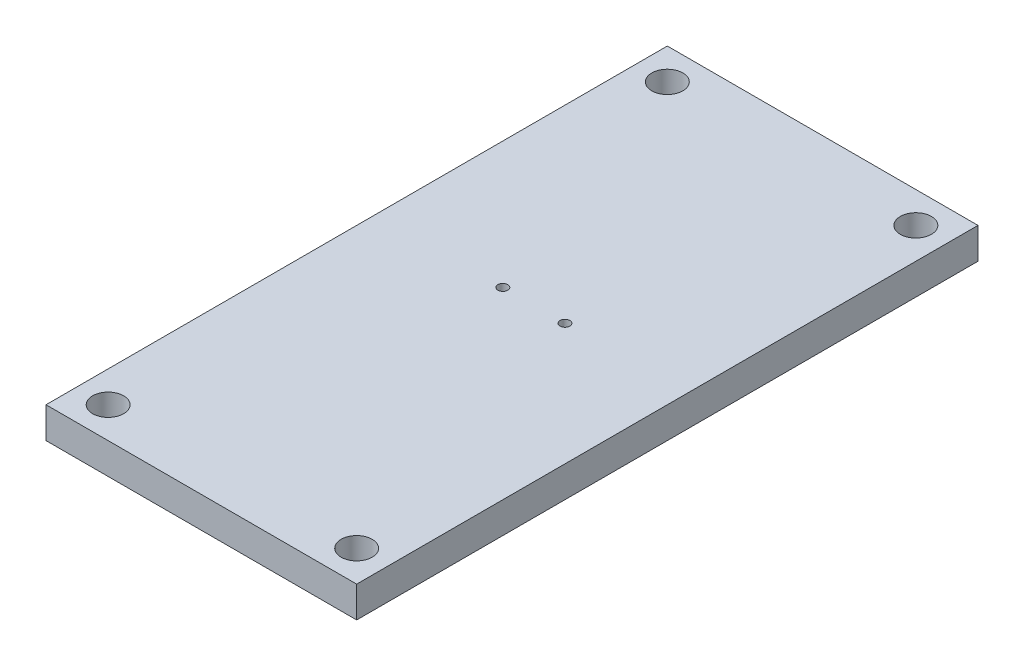
from build123d import *

# Parameters (mm, degrees)
SKETCH1_W               = 50
SKETCH1_H               = 100
BOSS_EXTRUDE1_DEPTH     = 5
CUT_EXTRUDE1_DEPTH      = 57.124860802
CUT_EXTRUDE1_DEPTH_BACK = 6
SKETCH2_R               = 0.791259191
CUT_EXTRUDE2_DEPTH      = 57.124860802
CUT_EXTRUDE2_DEPTH_BACK = 57.124860802
SKETCH2_3_R             = 0.791259191
CUT_EXTRUDE3_DEPTH      = 57.124860802
CUT_EXTRUDE3_DEPTH_BACK = 57.124860802
SKETCH3_R               = 2.5


with BuildPart() as part:
    # Sketch1 → Boss-Extrude1 (new body)
    with BuildSketch(Plane(origin=(0, 0, 0), x_dir=(1, 0, 0), z_dir=(0, 1, 0))):
        Rectangle(SKETCH1_W, SKETCH1_H)
    extrude(amount=BOSS_EXTRUDE1_DEPTH)

    # Sketch2 → Cut-Extrude1 (cut, two sides: drawn at the far end of the back side and taken through both)
    with BuildSketch(Plane(origin=(0, 5, 0), x_dir=(1, 0, 0), z_dir=(0, 1, 0)).offset(-CUT_EXTRUDE1_DEPTH_BACK)):
        with Locations((-4.591141379, 3.116041861)):
            Circle(SKETCH2_R)
    extrude(amount=CUT_EXTRUDE1_DEPTH + CUT_EXTRUDE1_DEPTH_BACK, mode=Mode.SUBTRACT)

    # Sketch2<3> → Cut-Extrude2 (cut, two sides: drawn at the far end of the back side and taken through both)
    with BuildSketch(Plane(origin=(0, 5, 0), x_dir=(1, 0, 0), z_dir=(0, 1, 0)).offset(-CUT_EXTRUDE2_DEPTH_BACK)):
        with Locations((5.408858621, 3.116041861)):
            Circle(SKETCH2_3_R)
        with Locations((-4.591141379, 3.116041861)):
            Circle(SKETCH2_3_R)
    extrude(amount=CUT_EXTRUDE2_DEPTH + CUT_EXTRUDE2_DEPTH_BACK, mode=Mode.SUBTRACT)

    # Sketch3 → Cut-Extrude3 (cut, two sides: drawn at the far end of the back side and taken through both)
    with BuildSketch(Plane.XZ.offset(-CUT_EXTRUDE3_DEPTH_BACK)):
        with Locations((-20, 45)):
            Circle(SKETCH3_R)
        with Locations((20, 45)):
            Circle(SKETCH3_R)
        with Locations((20, -45)):
            Circle(SKETCH3_R)
        with Locations((-20, -45)):
            Circle(SKETCH3_R)
    extrude(amount=CUT_EXTRUDE3_DEPTH + CUT_EXTRUDE3_DEPTH_BACK, mode=Mode.SUBTRACT)


solid = part.part
